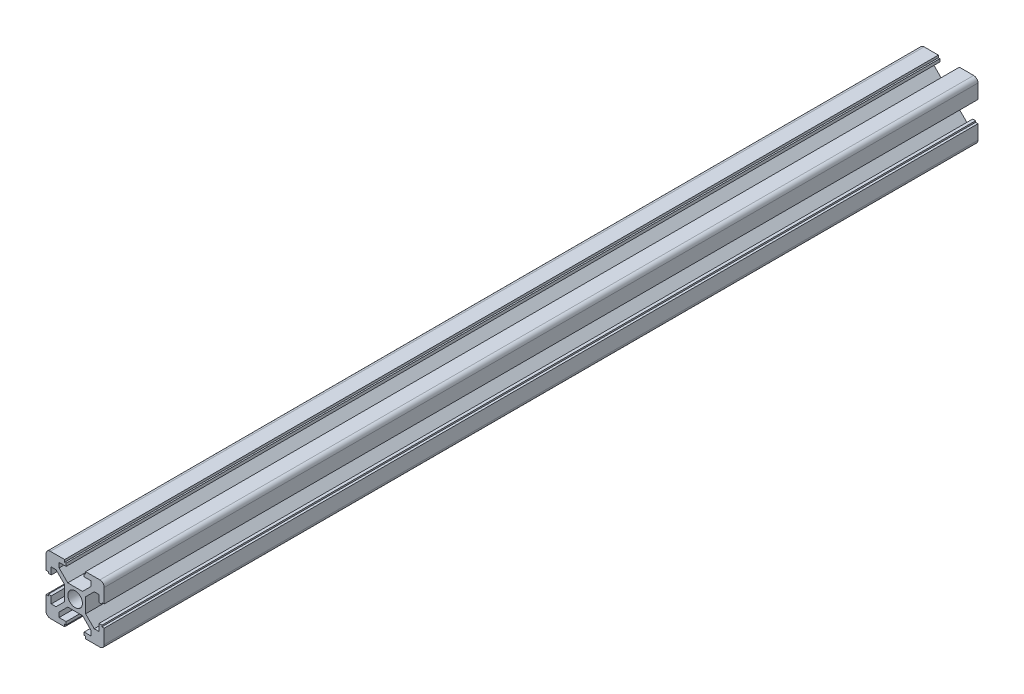
from build123d import *

# Parameters (mm, degrees)
SKETCH_2_R      = 2.5
EXTRUDE_1_DEPTH = 300


with BuildPart() as part:
    # 草图2 → 凸台-拉伸1 (new body)
    with BuildSketch(Plane.XY):
        with BuildLine():
            Line((-5.825824942, 5.993206118), (-5.825824942, 0.914526462))
            Line((-5.825824942, 0.914526462), (-8.786485114, -2.04613371))
            Line((-8.786485114, -2.04613371), (-10.425824942, -2.04613371))
            Line((-10.425824942, -2.04613371), (-10.425824942, 0.35386629))
            Line((-10.425824942, 0.35386629), (-11.425824942, 0.35386629))
            Line((-11.425824942, 0.35386629), (-11.425824942, -0.14613371))
            Line((-11.425824942, -0.14613371), (-12.225824942, -0.14613371))
            Line((-12.225824942, -0.14613371), (-12.225824942, -5.04613371))
            ThreePointArc((-12.225824942, -5.04613371), (-11.786485114, -6.106793882), (-10.725824942, -6.54613371))
            Line((-10.725824942, -6.54613371), (-5.825824942, -6.54613371))
            Line((-5.825824942, -6.54613371), (-5.825824942, -5.74613371))
            Line((-5.825824942, -5.74613371), (-5.325824942, -5.74613371))
            Line((-5.325824942, -5.74613371), (-5.325824942, -4.74613371))
            Line((-5.325824942, -4.74613371), (-7.725824942, -4.74613371))
            Line((-7.725824942, -4.74613371), (-7.725824942, -3.106793882))
            Line((-7.725824942, -3.106793882), (-4.765164771, -0.14613371))
            Line((-4.765164771, -0.14613371), (0.313514886, -0.14613371))
            Line((0.313514886, -0.14613371), (3.274175058, -3.106793882))
            Line((3.274175058, -3.106793882), (3.274175058, -4.74613371))
            Line((3.274175058, -4.74613371), (0.874175058, -4.74613371))
            Line((0.874175058, -4.74613371), (0.874175058, -5.74613371))
            Line((0.874175058, -5.74613371), (1.374175058, -5.74613371))
            Line((1.374175058, -5.74613371), (1.374175058, -6.54613371))
            Line((1.374175058, -6.54613371), (6.274175058, -6.54613371))
            ThreePointArc((6.274175058, -6.54613371), (7.334835229, -6.106793882), (7.774175058, -5.04613371))
            Line((7.774175058, -5.04613371), (7.774175058, -0.14613371))
            Line((7.774175058, -0.14613371), (6.974175058, -0.14613371))
            Line((6.974175058, -0.14613371), (6.974175058, 0.35386629))
            Line((6.974175058, 0.35386629), (5.974175058, 0.35386629))
            Line((5.974175058, 0.35386629), (5.974175058, -2.04613371))
            Line((5.974175058, -2.04613371), (4.334835229, -2.04613371))
            Line((4.334835229, -2.04613371), (1.374175058, 0.914526462))
            Line((1.374175058, 0.914526462), (1.374175058, 5.993206118))
            Line((1.374175058, 5.993206118), (4.334835229, 8.95386629))
            Line((4.334835229, 8.95386629), (5.974175058, 8.95386629))
            Line((5.974175058, 8.95386629), (5.974175058, 6.55386629))
            Line((5.974175058, 6.55386629), (6.974175058, 6.55386629))
            Line((6.974175058, 6.55386629), (6.974175058, 7.05386629))
            Line((6.974175058, 7.05386629), (7.774175058, 7.05386629))
            Line((7.774175058, 7.05386629), (7.774175058, 11.95386629))
            ThreePointArc((7.774175058, 11.95386629), (7.334835229, 13.014526462), (6.274175058, 13.45386629))
            Line((6.274175058, 13.45386629), (1.374175058, 13.45386629))
            Line((1.374175058, 13.45386629), (1.374175058, 12.65386629))
            Line((1.374175058, 12.65386629), (0.874175058, 12.65386629))
            Line((0.874175058, 12.65386629), (0.874175058, 11.65386629))
            Line((0.874175058, 11.65386629), (3.274175058, 11.65386629))
            Line((3.274175058, 11.65386629), (3.274175058, 10.014526462))
            Line((3.274175058, 10.014526462), (0.313514886, 7.05386629))
            Line((0.313514886, 7.05386629), (-4.765164771, 7.05386629))
            Line((-4.765164771, 7.05386629), (-7.725824942, 10.014526462))
            Line((-7.725824942, 10.014526462), (-7.725824942, 11.65386629))
            Line((-7.725824942, 11.65386629), (-5.325824942, 11.65386629))
            Line((-5.325824942, 11.65386629), (-5.325824942, 12.65386629))
            Line((-5.325824942, 12.65386629), (-5.825824942, 12.65386629))
            Line((-5.825824942, 12.65386629), (-5.825824942, 13.45386629))
            Line((-5.825824942, 13.45386629), (-10.725824942, 13.45386629))
            ThreePointArc((-10.725824942, 13.45386629), (-11.786485114, 13.014526462), (-12.225824942, 11.95386629))
            Line((-12.225824942, 11.95386629), (-12.225824942, 7.05386629))
            Line((-12.225824942, 7.05386629), (-11.425824942, 7.05386629))
            Line((-11.425824942, 7.05386629), (-11.425824942, 6.55386629))
            Line((-11.425824942, 6.55386629), (-10.425824942, 6.55386629))
            Line((-10.425824942, 6.55386629), (-10.425824942, 8.95386629))
            Line((-10.425824942, 8.95386629), (-8.786485114, 8.95386629))
            Line((-8.786485114, 8.95386629), (-5.825824942, 5.993206118))
        make_face()
        with Locations((-2.225824942, 3.45386629)):
            Circle(SKETCH_2_R, mode=Mode.SUBTRACT)
    extrude(amount=EXTRUDE_1_DEPTH)


solid = part.part
